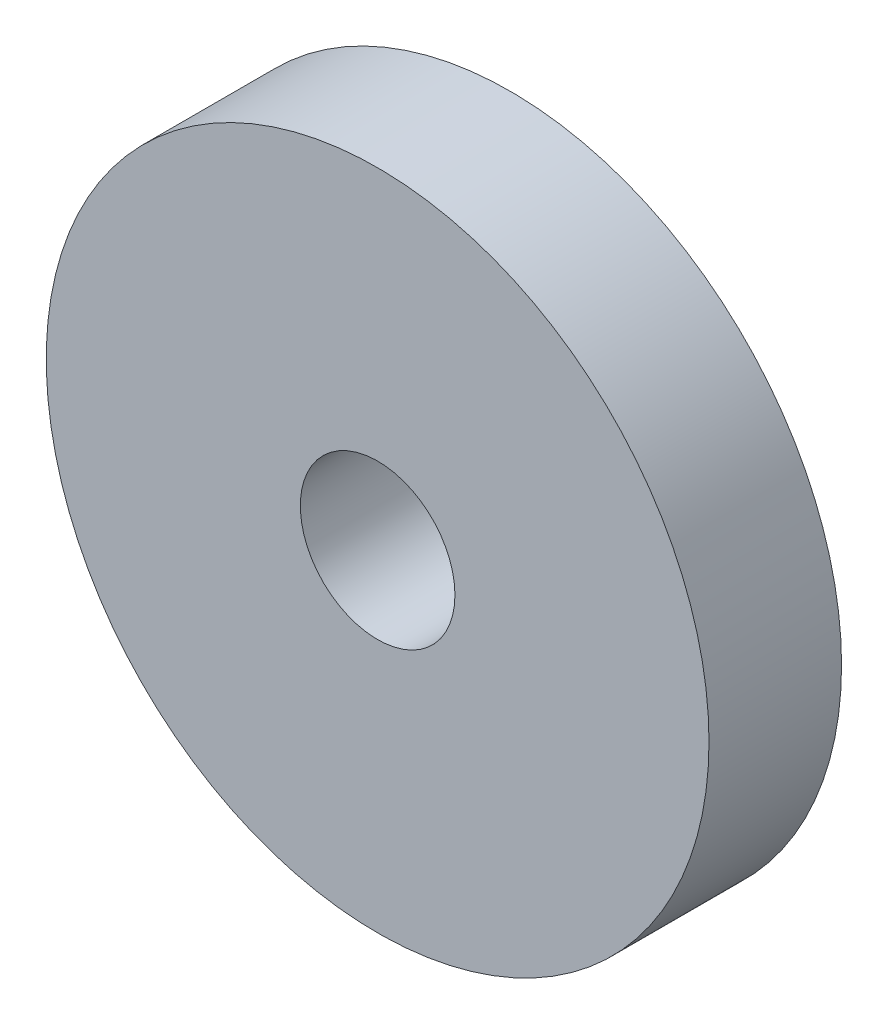
from build123d import *

# Parameters (mm, degrees)
SKETCH1_R           = 7.5
SKETCH1_R_2         = 1.75
BOSS_EXTRUDE1_DEPTH = 3


with BuildPart() as part:
    # Sketch1 → Boss-Extrude1 (new body)
    with BuildSketch(Plane.XY):
        Circle(SKETCH1_R)
        Circle(SKETCH1_R_2, mode=Mode.SUBTRACT)
    extrude(amount=BOSS_EXTRUDE1_DEPTH)


solid = part.part
